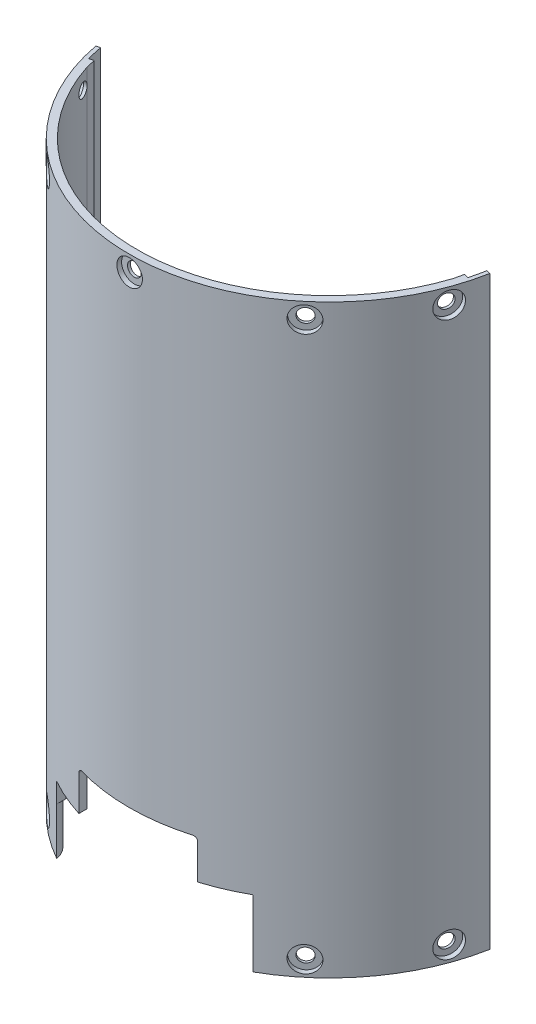
from build123d import *

# Parameters (mm, degrees)
EXTRUDE_1_DEPTH          = 149
CUT_EXTRUDE_1_DEPTH      = 12
CUT_EXTRUDE_2_DEPTH      = 5
CUT_EXTRUDE_START        = -10
CUT_EXTRUDE_3_DEPTH      = 10
FILLET_1_R               = 1
SKETCH_6_R               = 3.25
CUT_EXTRUDE_5_DEPTH      = 1.3
SKETCH_7_R               = 1.75
CUT_EXTRUDE_6_DEPTH      = 163.352474968
PATTERN_CIRCULAR_1_COUNT = 10
PATTERN_CIRCULAR_1_ANGLE = 90
PATTERN_CIRCULAR_2_COUNT = 10
PATTERN_CIRCULAR_2_ANGLE = 90
SKETCH_8_R               = 3.25
CUT_EXTRUDE_7_DEPTH      = 1.3
SKETCH_9_R               = 1.75
CUT_EXTRUDE_8_DEPTH      = 181.925149365
PATTERN_CIRCULAR_3_COUNT = 4
PATTERN_CIRCULAR_3_ANGLE = 30
MIRROR_1_COPY_1_SKETCH_R = 3.25
MIRROR_1_COPY_1_DEPTH    = 1.3
MIRROR_1_COPY_2_SKETCH_R = 1.75
MIRROR_1_COPY_2_DEPTH    = 181.925149365


with BuildPart() as part:
    # Эскиз1 → Бобышка-Вытянуть1 (new body)
    with BuildSketch(Plane(origin=(0, 0, 0), x_dir=(1, 0, 0), z_dir=(0, 1, 0))):
        with BuildLine():
            Line((-49.155394108, -9.151351269), (-50.131159715, -9.373730613))
            ThreePointArc((-50.131159715, -9.373730613), (-41.45838783, -29.701886784), (-25, -44.452221542))
            ThreePointArc((-25, -44.452221542), (0, -51), (25, -44.452221542))
            ThreePointArc((25, -44.452221542), (41.45838783, -29.701886784), (50.131159715, -9.373730613))
            Line((50.131159715, -9.373730613), (49.155394108, -9.151351269))
            ThreePointArc((49.155394108, -9.151351269), (48.75, -11.110243022), (48.266574667, -13.051351269))
            Line((48.266574667, -13.051351269), (47.135590279, -12.793597189))
            Line((47.135590279, -12.793597189), (46.597261479, -15.155699345))
            ThreePointArc((46.597261479, -15.155699345), (39.178364628, -29.428825071), (27.53711134, -40.530328139))
            ThreePointArc((27.53711134, -40.530328139), (0, -49), (-27.53711134, -40.530328139))
            ThreePointArc((-27.53711134, -40.530328139), (-39.178364628, -29.428825071), (-46.597261479, -15.155699345))
            Line((-46.597261479, -15.155699345), (-47.135590279, -12.793597189))
            Line((-47.135590279, -12.793597189), (-48.266574667, -13.051351269))
            ThreePointArc((-48.266574667, -13.051351269), (-48.75, -11.110243022), (-49.155394108, -9.151351269))
        make_face()
    extrude(amount=EXTRUDE_1_DEPTH)

    # Эскиз3 → Вырез-Вытянуть1 (cut)
    with BuildSketch(Plane(origin=(0, 0, 0), x_dir=(1, 0, 0), z_dir=(0, 1, 0))):
        with BuildLine():
            ThreePointArc((-25, -44.452221542), (0, -51), (25, -44.452221542))
            ThreePointArc((25, -44.452221542), (25.871239234, -42.234246937), (27.53711134, -40.530328139))
            ThreePointArc((27.53711134, -40.530328139), (0, -49), (-27.53711134, -40.530328139))
            ThreePointArc((-27.53711134, -40.530328139), (-25.871239234, -42.234246937), (-25, -44.452221542))
        make_face()
    extrude(amount=CUT_EXTRUDE_1_DEPTH, mode=Mode.SUBTRACT)

    # Эскиз4 → Вырез-Вытянуть2 (cut)
    with BuildSketch(Plane.XZ.offset(-12)):
        with BuildLine():
            Line((-25, 42.142615011), (-25, 44.452221542))
            ThreePointArc((-25, 44.452221542), (0, 51), (25, 44.452221542))
            Line((25, 44.452221542), (25, 42.142615011))
            ThreePointArc((25, 42.142615011), (0, 49), (-25, 42.142615011))
        make_face()
    extrude(amount=-CUT_EXTRUDE_2_DEPTH, mode=Mode.SUBTRACT)

    # Эскиз5 → Вырез-Вытянуть3 (cut)
    with BuildSketch(Plane.XZ.offset(-17).offset(CUT_EXTRUDE_START)):
        with BuildLine():
            Line((-15.1, 46.089478192), (-15.1, 49.236571773))
            ThreePointArc((-15.1, 49.236571773), (0, 51.5), (15.1, 49.236571773))
            Line((15.1, 49.236571773), (15.1, 46.089478192))
            ThreePointArc((15.1, 46.089478192), (0, 48.5), (-15.1, 46.089478192))
        make_face()
    extrude(amount=CUT_EXTRUDE_3_DEPTH, mode=Mode.SUBTRACT)

    # Скругление1
    fillet_1_edges = [part.edges().sort_by_distance(p)[0] for p in [
        (-15.1, 27, 47.664343008),
        (15.1, 27, 47.664343008),
    ]]
    fillet(fillet_1_edges, radius=FILLET_1_R)

    # Эскиз6 → Вырез-Вытянуть5 (cut)
    with BuildSketch(Plane.XY.offset(51)):
        with Locations((0, 145)):
            Circle(SKETCH_6_R)
    cut_extrude_5 = extrude(amount=-CUT_EXTRUDE_5_DEPTH, mode=Mode.SUBTRACT)

    # Эскиз7 → Вырез-Вытянуть6 (cut, through all)
    with BuildSketch(Plane.XY.offset(49.7)):
        with Locations((0, 145)):
            Circle(SKETCH_7_R)
    cut_extrude_6 = extrude(amount=-CUT_EXTRUDE_6_DEPTH, mode=Mode.SUBTRACT)

    # Круговой массив1: Вырез-Вытянуть5, Вырез-Вытянуть6 ×10 about axis, 7 skipped
    pattern_circular_1_axis = Axis((0, 149, 0), (0, -1, 0))
    add([cut_extrude_5.rotate(pattern_circular_1_axis, i * PATTERN_CIRCULAR_1_ANGLE / (PATTERN_CIRCULAR_1_COUNT - 1)) for i in range(1, PATTERN_CIRCULAR_1_COUNT) if i not in (1, 2, 3, 5, 6, 8, 9)], mode=Mode.SUBTRACT)
    add([cut_extrude_6.rotate(pattern_circular_1_axis, i * PATTERN_CIRCULAR_1_ANGLE / (PATTERN_CIRCULAR_1_COUNT - 1)) for i in range(1, PATTERN_CIRCULAR_1_COUNT) if i not in (1, 2, 3, 5, 6, 8, 9)], mode=Mode.SUBTRACT)

    # Круговой массив2: Вырез-Вытянуть5, Вырез-Вытянуть6 ×10 about axis, 7 skipped
    pattern_circular_2_axis = Axis((0, 149, 0), (0, 1, 0))
    add([cut_extrude_5.rotate(pattern_circular_2_axis, i * PATTERN_CIRCULAR_2_ANGLE / (PATTERN_CIRCULAR_2_COUNT - 1)) for i in range(1, PATTERN_CIRCULAR_2_COUNT) if i not in (1, 2, 3, 5, 6, 8, 9)], mode=Mode.SUBTRACT)
    add([cut_extrude_6.rotate(pattern_circular_2_axis, i * PATTERN_CIRCULAR_2_ANGLE / (PATTERN_CIRCULAR_2_COUNT - 1)) for i in range(1, PATTERN_CIRCULAR_2_COUNT) if i not in (1, 2, 3, 5, 6, 8, 9)], mode=Mode.SUBTRACT)

    # Эскиз8 → Вырез-Вытянуть7 (cut)
    with BuildSketch(Plane(origin=(-47.92432366, 0, 17.44302731), x_dir=(0, -1, 0), z_dir=(-0.9396926207859094, 0, 0.34202014332566616))):
        with Locations(Location((-4, 0, 0), (0, 0, 90))):
            Circle(SKETCH_8_R)
    cut_extrude_7 = extrude(amount=-CUT_EXTRUDE_7_DEPTH, mode=Mode.SUBTRACT)

    # Эскиз9 → Вырез-Вытянуть8 (cut, through all)
    with BuildSketch(Plane(origin=(-46.702723253, 0, 16.998401123), x_dir=(0.34202014332566616, 0, 0.9396926207859094), z_dir=(-0.9396926207859094, 0, 0.34202014332566616))):
        with Locations((0, 4)):
            Circle(SKETCH_9_R)
    cut_extrude_8 = extrude(amount=-CUT_EXTRUDE_8_DEPTH, mode=Mode.SUBTRACT)

    # Круговой массив3: Вырез-Вытянуть7, Вырез-Вытянуть8 ×4 about axis, 2 skipped
    pattern_circular_3_axis = Axis((0, 0, 0), (0, 1, 0))
    add([cut_extrude_7.rotate(pattern_circular_3_axis, i * PATTERN_CIRCULAR_3_ANGLE / (PATTERN_CIRCULAR_3_COUNT - 1)) for i in range(1, PATTERN_CIRCULAR_3_COUNT) if i not in (1, 2)], mode=Mode.SUBTRACT)
    add([cut_extrude_8.rotate(pattern_circular_3_axis, i * PATTERN_CIRCULAR_3_ANGLE / (PATTERN_CIRCULAR_3_COUNT - 1)) for i in range(1, PATTERN_CIRCULAR_3_COUNT) if i not in (1, 2)], mode=Mode.SUBTRACT)

    # Зеркальное отражение1: Вырез-Вытянуть7, Вырез-Вытянуть8 across plane
    add(cut_extrude_7.mirror(Plane(origin=(0, 0, 0), x_dir=(0, 0, 1), z_dir=(1, 0, 0))), mode=Mode.SUBTRACT)
    add(cut_extrude_8.mirror(Plane(origin=(0, 0, 0), x_dir=(0, 0, 1), z_dir=(1, 0, 0))), mode=Mode.SUBTRACT)

    # Зеркальное отражение1 copy 1 sketch → Зеркальное отражение1 copy 1 (cut)
    with BuildSketch(Plane(origin=(32.782168094, 0, 39.068266599), x_dir=(0, -1, 0), z_dir=(0.6427876096865406, 0, 0.7660444431189772))):
        with Locations((-4, 0)):
            Circle(MIRROR_1_COPY_1_SKETCH_R)
    extrude(amount=-MIRROR_1_COPY_1_DEPTH, mode=Mode.SUBTRACT)

    # Зеркальное отражение1 copy 2 sketch → Зеркальное отражение1 copy 2 (cut, through all)
    with BuildSketch(Plane(origin=(31.946544201, 0, 38.072408823), x_dir=(-0.7660444431189772, 0, 0.6427876096865406), z_dir=(0.6427876096865406, 0, 0.7660444431189772))):
        with Locations((0, -4)):
            Circle(MIRROR_1_COPY_2_SKETCH_R)
    extrude(amount=-MIRROR_1_COPY_2_DEPTH, mode=Mode.SUBTRACT)


solid = part.part
